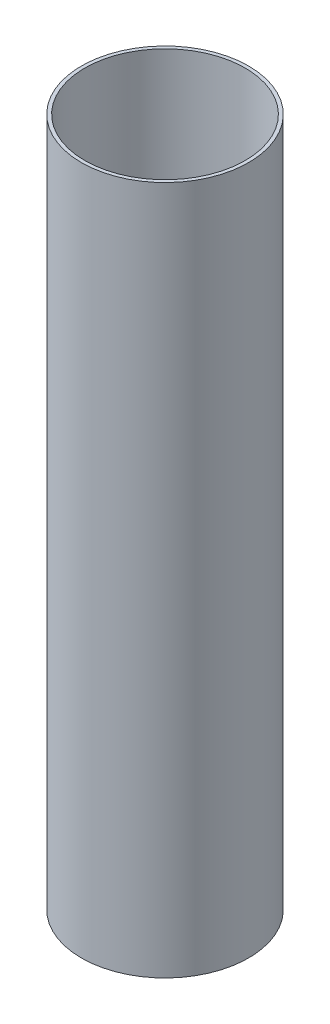
from build123d import *

# Parameters (mm, degrees)
CROQUIS1_R              = 85
SALIENTE_EXTRUIR1_DEPTH = 700
VACIADO1_T              = -3.5


with BuildPart() as part:
    # Croquis1 → Saliente-Extruir1 (new body)
    with BuildSketch(Plane(origin=(0, 0, 0), x_dir=(1, 0, 0), z_dir=(0, 1, 0))):
        with Locations(Location((0, 0, 0), (0, 0, 270))):
            Circle(CROQUIS1_R)
    extrude(amount=SALIENTE_EXTRUIR1_DEPTH)

    # Vaciado1
    vaciado1_openings = [part.faces().sort_by_distance(p)[0] for p in [
        (0, 700, 0),
    ]]
    offset(amount=VACIADO1_T, openings=vaciado1_openings, kind=Kind.INTERSECTION)


solid = part.part
